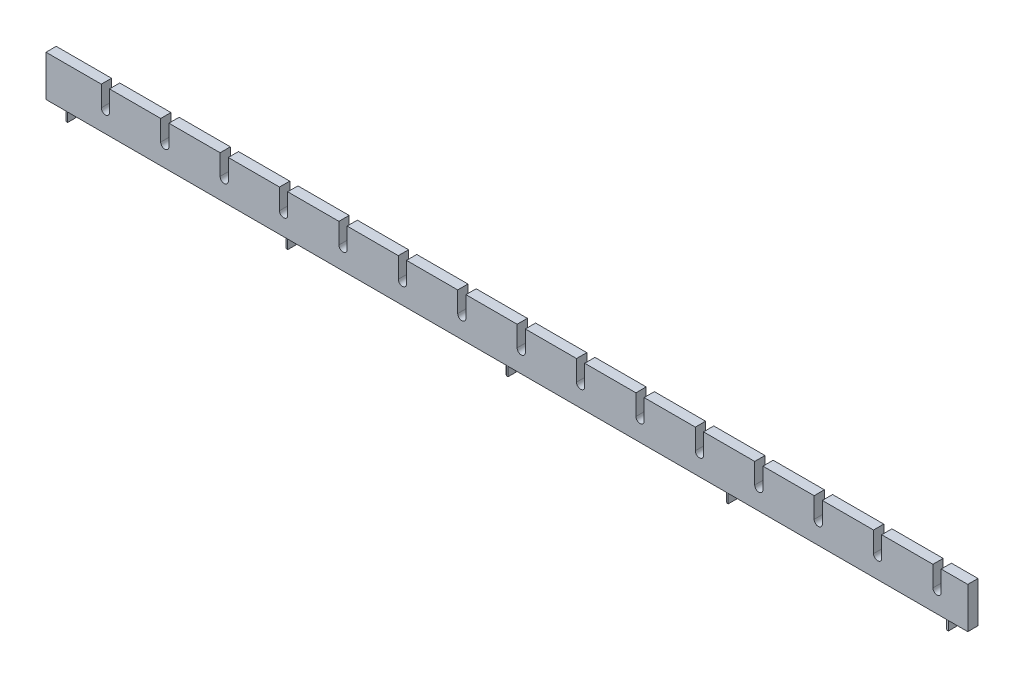
from build123d import *

# Parameters (mm, degrees)
SKETCH1_W           = 571.5
SKETCH1_H           = 6.35
BOSS_EXTRUDE1_DEPTH = 25.4
BOSS_EXTRUDE2_DEPTH = 6.35
CUT_EXTRUDE1_DEPTH  = 287.946937603


with BuildPart() as part:
    # Sketch1 → Boss-Extrude1 (new body)
    with BuildSketch(Plane(origin=(0, 0, 0), x_dir=(1, 0, 0), z_dir=(0, 1, 0))):
        Rectangle(SKETCH1_W, SKETCH1_H)
    extrude(amount=BOSS_EXTRUDE1_DEPTH)

    # Sketch2 → Boss-Extrude2 (add)
    with BuildSketch(Plane.XZ):
        with BuildLine():
            Line((-273.05, 2.54), (-273.05, -2.54))
            ThreePointArc((-273.05, -2.54), (-275.59, 0), (-273.05, 2.54))
        make_face()
        with BuildLine():
            Line((-136.525, 2.54), (-136.525, -2.54))
            ThreePointArc((-136.525, -2.54), (-139.065, 0), (-136.525, 2.54))
        make_face()
        with BuildLine():
            Line((0, 2.54), (0, -2.54))
            ThreePointArc((0, -2.54), (-2.54, 0), (0, 2.54))
        make_face()
        with BuildLine():
            Line((136.525, 2.54), (136.525, -2.54))
            ThreePointArc((136.525, -2.54), (133.985, 0), (136.525, 2.54))
        make_face()
        with BuildLine():
            Line((273.05, 2.54), (273.05, -2.54))
            ThreePointArc((273.05, -2.54), (270.51, 0), (273.05, 2.54))
        make_face()
    extrude(amount=BOSS_EXTRUDE2_DEPTH)

    # Sketch3 → Cut-Extrude1 (cut, through all)
    with BuildSketch(Plane.XY.offset(3.175)):
        with BuildLine():
            Line((-246.38, 38.1), (-246.38, 12.7))
            ThreePointArc((-246.38, 12.7), (-248.92, 10.16), (-251.46, 12.7))
            Line((-251.46, 12.7), (-251.46, 38.1))
            ThreePointArc((-251.46, 38.1), (-248.92, 40.64), (-246.38, 38.1))
        make_face()
        with BuildLine():
            Line((-209.55, 38.1), (-209.55, 12.7))
            ThreePointArc((-209.55, 12.7), (-212.09, 10.16), (-214.63, 12.7))
            Line((-214.63, 12.7), (-214.63, 38.1))
            ThreePointArc((-214.63, 38.1), (-212.09, 40.64), (-209.55, 38.1))
        make_face()
        with BuildLine():
            Line((-172.72, 38.1), (-172.72, 12.7))
            ThreePointArc((-172.72, 12.7), (-175.26, 10.16), (-177.8, 12.7))
            Line((-177.8, 12.7), (-177.8, 38.1))
            ThreePointArc((-177.8, 38.1), (-175.26, 40.64), (-172.72, 38.1))
        make_face()
        with BuildLine():
            Line((-135.89, 38.1), (-135.89, 12.7))
            ThreePointArc((-135.89, 12.7), (-138.43, 10.16), (-140.97, 12.7))
            Line((-140.97, 12.7), (-140.97, 38.1))
            ThreePointArc((-140.97, 38.1), (-138.43, 40.64), (-135.89, 38.1))
        make_face()
        with BuildLine():
            Line((-99.06, 38.1), (-99.06, 12.7))
            ThreePointArc((-99.06, 12.7), (-101.6, 10.16), (-104.14, 12.7))
            Line((-104.14, 12.7), (-104.14, 38.1))
            ThreePointArc((-104.14, 38.1), (-101.6, 40.64), (-99.06, 38.1))
        make_face()
        with BuildLine():
            Line((-62.23, 38.1), (-62.23, 12.7))
            ThreePointArc((-62.23, 12.7), (-64.77, 10.16), (-67.31, 12.7))
            Line((-67.31, 12.7), (-67.31, 38.1))
            ThreePointArc((-67.31, 38.1), (-64.77, 40.64), (-62.23, 38.1))
        make_face()
        with BuildLine():
            Line((-25.4, 38.1), (-25.4, 12.7))
            ThreePointArc((-25.4, 12.7), (-27.94, 10.16), (-30.48, 12.7))
            Line((-30.48, 12.7), (-30.48, 38.1))
            ThreePointArc((-30.48, 38.1), (-27.94, 40.64), (-25.4, 38.1))
        make_face()
        with BuildLine():
            Line((11.43, 38.1), (11.43, 12.7))
            ThreePointArc((11.43, 12.7), (8.89, 10.16), (6.35, 12.7))
            Line((6.35, 12.7), (6.35, 38.1))
            ThreePointArc((6.35, 38.1), (8.89, 40.64), (11.43, 38.1))
        make_face()
        with BuildLine():
            Line((48.26, 38.1), (48.26, 12.7))
            ThreePointArc((48.26, 12.7), (45.72, 10.16), (43.18, 12.7))
            Line((43.18, 12.7), (43.18, 38.1))
            ThreePointArc((43.18, 38.1), (45.72, 40.64), (48.26, 38.1))
        make_face()
        with BuildLine():
            Line((85.09, 38.1), (85.09, 12.7))
            ThreePointArc((85.09, 12.7), (82.55, 10.16), (80.01, 12.7))
            Line((80.01, 12.7), (80.01, 38.1))
            ThreePointArc((80.01, 38.1), (82.55, 40.64), (85.09, 38.1))
        make_face()
        with BuildLine():
            Line((121.92, 38.1), (121.92, 12.7))
            ThreePointArc((121.92, 12.7), (119.38, 10.16), (116.84, 12.7))
            Line((116.84, 12.7), (116.84, 38.1))
            ThreePointArc((116.84, 38.1), (119.38, 40.64), (121.92, 38.1))
        make_face()
        with BuildLine():
            Line((158.75, 38.1), (158.75, 12.7))
            ThreePointArc((158.75, 12.7), (156.21, 10.16), (153.67, 12.7))
            Line((153.67, 12.7), (153.67, 38.1))
            ThreePointArc((153.67, 38.1), (156.21, 40.64), (158.75, 38.1))
        make_face()
        with BuildLine():
            Line((195.58, 38.1), (195.58, 12.7))
            ThreePointArc((195.58, 12.7), (193.04, 10.16), (190.5, 12.7))
            Line((190.5, 12.7), (190.5, 38.1))
            ThreePointArc((190.5, 38.1), (193.04, 40.64), (195.58, 38.1))
        make_face()
        with BuildLine():
            Line((232.41, 38.1), (232.41, 12.7))
            ThreePointArc((232.41, 12.7), (229.87, 10.16), (227.33, 12.7))
            Line((227.33, 12.7), (227.33, 38.1))
            ThreePointArc((227.33, 38.1), (229.87, 40.64), (232.41, 38.1))
        make_face()
        with BuildLine():
            Line((269.24, 38.1), (269.24, 12.7))
            ThreePointArc((269.24, 12.7), (266.7, 10.16), (264.16, 12.7))
            Line((264.16, 12.7), (264.16, 38.1))
            ThreePointArc((264.16, 38.1), (266.7, 40.64), (269.24, 38.1))
        make_face()
    extrude(amount=-CUT_EXTRUDE1_DEPTH, mode=Mode.SUBTRACT)


solid = part.part
